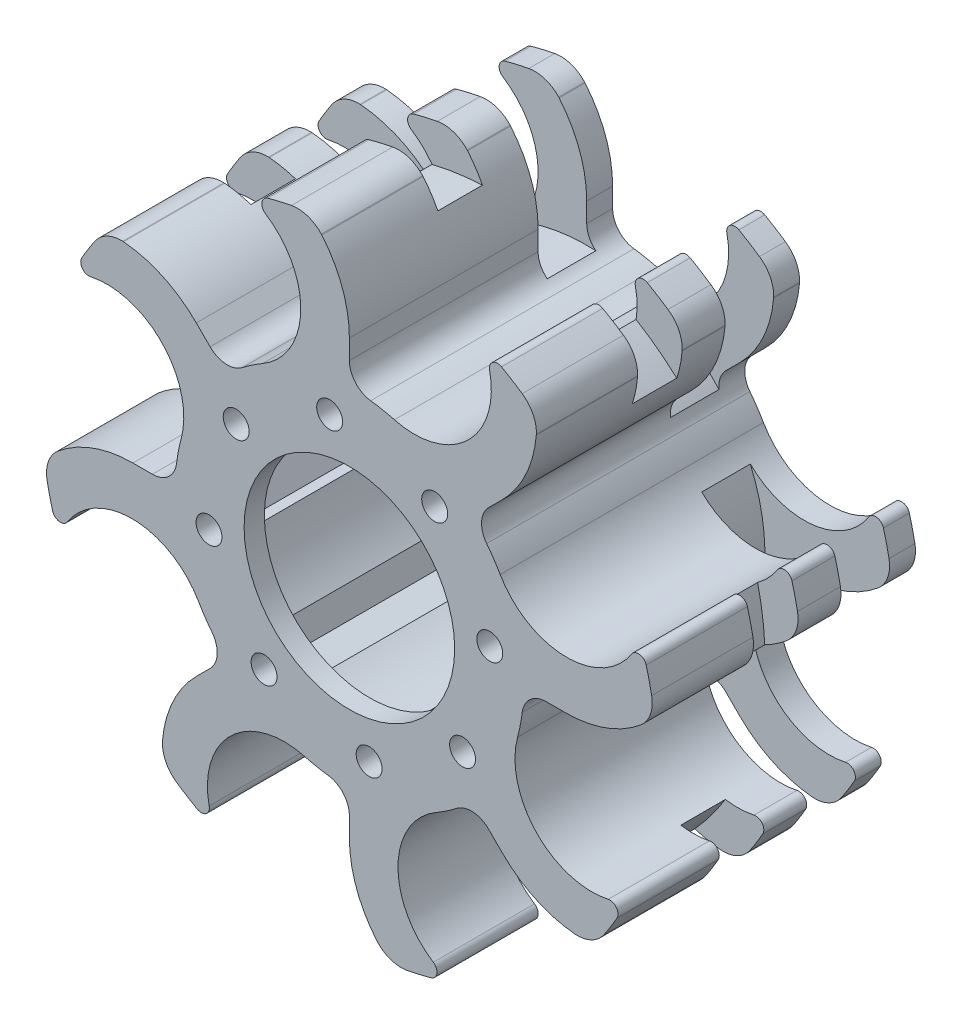
from build123d import *

# Parameters (mm, degrees)
EXTRUDE_1_DEPTH          = 32.5
PATTERN_CIRCULAR_1_COUNT = 8
FILLET_1_R               = 3
SKETCH_3_R               = 18.5
CUT_EXTRUDE_1_DEPTH      = 30
SKETCH_4_R               = 1.6
SKETCH_4_R_2             = 13
CUT_EXTRUDE_2_DEPTH      = 2.5
CUT_EXTRUDE_4_REACH      = 62.798
SKETCH_7_W               = 20
SKETCH_7_H               = 6
SKETCH_7_W_2             = 10
SKETCH_7_H_2             = 5.5


with BuildPart() as part:
    # 草图1 → 凸台-拉伸1 (new body)
    with BuildSketch(Plane.XY):
        with BuildLine():
            ThreePointArc((-10.356244554, 34.83376316), (-6.00280003, 26.616152007), (-10.75, 18.619546181))
            ThreePointArc((-10.75, 18.619546181), (5.56460947, -20.767405265), (0, 21.5))
            Line((0, 21.5), (0, 26.721510215))
            ThreePointArc((0, 26.721510215), (-0.876562566, 31.680090761), (-3.4, 36.037629801))
            ThreePointArc((-3.4, 36.037629801), (-3.429921119, 36.072346995), (-3.460629906, 36.106369449))
            ThreePointArc((-3.460629906, 36.106369449), (-5.148861305, 37.192002716), (-7.15188578, 37.320912767))
            ThreePointArc((-7.15188578, 37.320912767), (-8.622723673, 37.00876432), (-10.080061386, 36.638673044))
            ThreePointArc((-10.080061386, 36.638673044), (-10.803291061, 35.82575459), (-10.356244554, 34.83376316))
        make_face()
    extrude_1 = extrude(amount=EXTRUDE_1_DEPTH)

    # 阵列(圆周)1: 凸台-拉伸1 ×8 about axis
    pattern_circular_1_axis = Axis((0, 0, 0), (0, 0, 1))
    for i in range(1, PATTERN_CIRCULAR_1_COUNT):
        add(extrude_1.rotate(pattern_circular_1_axis, i * 360 / PATTERN_CIRCULAR_1_COUNT))

    # 圆角1
    fillet_1_edges = [part.edges().sort_by_distance(p)[0] for p in [
        (0, 21.5, 16.25),
        (-15.202795796, 15.202795796, 16.25),
        (-15.202795796, -15.202795796, 16.25),
        (15.202795796, -15.202795796, 16.25),
        (15.202795796, 15.202795796, 16.25),
        (21.5, 0, 16.25),
        (0, -21.5, 16.25),
        (-21.5, 0, 16.25),
    ]]
    fillet(fillet_1_edges, radius=FILLET_1_R)

    # 草图3 → 切除-拉伸1 (cut)
    with BuildSketch(Plane(origin=(0, 0, 0), x_dir=(-1, 0, 0), z_dir=(0, 0, -1))):
        Circle(SKETCH_3_R)
    extrude(amount=-CUT_EXTRUDE_1_DEPTH, mode=Mode.SUBTRACT)

    # 草图4 → 切除-拉伸2 (cut)
    with BuildSketch(Plane.XY.offset(32.5)):
        with Locations((-2.435529267, 17.329691203)):
            Circle(SKETCH_4_R)
        Circle(SKETCH_4_R_2)
        with Locations((10.531762905, 13.976121426)):
            Circle(SKETCH_4_R)
        with Locations((17.329691203, 2.435529267)):
            Circle(SKETCH_4_R)
        with Locations((13.976121426, -10.531762905)):
            Circle(SKETCH_4_R)
        with Locations((2.435529267, -17.329691203)):
            Circle(SKETCH_4_R)
        with Locations((-10.531762905, -13.976121426)):
            Circle(SKETCH_4_R)
        with Locations((-17.329691203, -2.435529267)):
            Circle(SKETCH_4_R)
        with Locations((-13.976121426, 10.531762905)):
            Circle(SKETCH_4_R)
    extrude(amount=-CUT_EXTRUDE_2_DEPTH, mode=Mode.SUBTRACT)

    # 草图6 → 切除-拉伸4 (cut, up to next)
    with BuildSketch(Plane(origin=(0, 0, 30), x_dir=(-1, 0, 0), z_dir=(0, 0, -1)), mode=Mode.PRIVATE) as cut_extrude_4_sk1:
        Polygon((2.435529267, 20.629691203), (-0.422354566, 18.979691203), (-0.422354566, 15.679691203), (2.435529267, 14.029691203), (5.293413099, 15.679691203), (5.293413099, 18.979691203), align=None)
    cut_extrude_4_tool1 = extrude(cut_extrude_4_sk1.sketch, amount=CUT_EXTRUDE_4_REACH, mode=Mode.PRIVATE) & part.part
    # 草图6 → 切除-拉伸4 (cut, up to next)
    with BuildSketch(Plane(origin=(0, 0, 30), x_dir=(-1, 0, 0), z_dir=(0, 0, -1)), mode=Mode.PRIVATE) as cut_extrude_4_sk2:
        Polygon((16.309573804, 12.865215283), (13.122018577, 13.719318132), (10.788566199, 11.385865754), (11.642669048, 8.198310527), (14.830224275, 7.344207678), (17.163676653, 9.677660056), align=None)
    cut_extrude_4_tool2 = extrude(cut_extrude_4_sk2.sketch, amount=CUT_EXTRUDE_4_REACH, mode=Mode.PRIVATE) & part.part
    # 草图6 → 切除-拉伸4 (cut, up to next)
    with BuildSketch(Plane(origin=(0, 0, 30), x_dir=(-1, 0, 0), z_dir=(0, 0, -1)), mode=Mode.PRIVATE) as cut_extrude_4_sk3:
        Polygon((20.629691203, -2.435529267), (18.979691203, 0.422354566), (15.679691203, 0.422354566), (14.029691203, -2.435529267), (15.679691203, -5.293413099), (18.979691203, -5.293413099), align=None)
    cut_extrude_4_tool3 = extrude(cut_extrude_4_sk3.sketch, amount=CUT_EXTRUDE_4_REACH, mode=Mode.PRIVATE) & part.part
    # 草图6 → 切除-拉伸4 (cut, up to next)
    with BuildSketch(Plane(origin=(0, 0, 30), x_dir=(-1, 0, 0), z_dir=(0, 0, -1)), mode=Mode.PRIVATE) as cut_extrude_4_sk4:
        Polygon((12.865215283, -16.309573804), (13.719318132, -13.122018577), (11.385865754, -10.788566199), (8.198310527, -11.642669048), (7.344207678, -14.830224275), (9.677660056, -17.163676653), align=None)
    cut_extrude_4_tool4 = extrude(cut_extrude_4_sk4.sketch, amount=CUT_EXTRUDE_4_REACH, mode=Mode.PRIVATE) & part.part
    # 草图6 → 切除-拉伸4 (cut, up to next)
    with BuildSketch(Plane(origin=(0, 0, 30), x_dir=(-1, 0, 0), z_dir=(0, 0, -1)), mode=Mode.PRIVATE) as cut_extrude_4_sk5:
        Polygon((-2.435529267, -20.629691203), (0.422354566, -18.979691203), (0.422354566, -15.679691203), (-2.435529267, -14.029691203), (-5.293413099, -15.679691203), (-5.293413099, -18.979691203), align=None)
    cut_extrude_4_tool5 = extrude(cut_extrude_4_sk5.sketch, amount=CUT_EXTRUDE_4_REACH, mode=Mode.PRIVATE) & part.part
    # 草图6 → 切除-拉伸4 (cut, up to next)
    with BuildSketch(Plane(origin=(0, 0, 30), x_dir=(-1, 0, 0), z_dir=(0, 0, -1)), mode=Mode.PRIVATE) as cut_extrude_4_sk6:
        Polygon((-16.309573804, -12.865215283), (-13.122018577, -13.719318132), (-10.788566199, -11.385865754), (-11.642669048, -8.198310527), (-14.830224275, -7.344207678), (-17.163676653, -9.677660056), align=None)
    cut_extrude_4_tool6 = extrude(cut_extrude_4_sk6.sketch, amount=CUT_EXTRUDE_4_REACH, mode=Mode.PRIVATE) & part.part
    # 草图6 → 切除-拉伸4 (cut, up to next)
    with BuildSketch(Plane(origin=(0, 0, 30), x_dir=(-1, 0, 0), z_dir=(0, 0, -1)), mode=Mode.PRIVATE) as cut_extrude_4_sk7:
        Polygon((-20.629691203, 2.435529267), (-18.979691203, -0.422354566), (-15.679691203, -0.422354566), (-14.029691203, 2.435529267), (-15.679691203, 5.293413099), (-18.979691203, 5.293413099), align=None)
    cut_extrude_4_tool7 = extrude(cut_extrude_4_sk7.sketch, amount=CUT_EXTRUDE_4_REACH, mode=Mode.PRIVATE) & part.part
    # 草图6 → 切除-拉伸4 (cut, up to next)
    with BuildSketch(Plane(origin=(0, 0, 30), x_dir=(-1, 0, 0), z_dir=(0, 0, -1)), mode=Mode.PRIVATE) as cut_extrude_4_sk8:
        Polygon((-12.865215283, 16.309573804), (-13.719318132, 13.122018577), (-11.385865754, 10.788566199), (-8.198310527, 11.642669048), (-7.344207678, 14.830224275), (-9.677660056, 17.163676653), align=None)
    cut_extrude_4_tool8 = extrude(cut_extrude_4_sk8.sketch, amount=CUT_EXTRUDE_4_REACH, mode=Mode.PRIVATE) & part.part
    add(cut_extrude_4_tool1.solids().sort_by_distance((-2.435529, 17.329691, 30))[0], mode=Mode.SUBTRACT)
    add(cut_extrude_4_tool2.solids().sort_by_distance((-13.976121, 10.531763, 30))[0], mode=Mode.SUBTRACT)
    add(cut_extrude_4_tool3.solids().sort_by_distance((-17.329691, -2.435529, 30))[0], mode=Mode.SUBTRACT)
    add(cut_extrude_4_tool4.solids().sort_by_distance((-10.531763, -13.976121, 30))[0], mode=Mode.SUBTRACT)
    add(cut_extrude_4_tool5.solids().sort_by_distance((2.435529, -17.329691, 30))[0], mode=Mode.SUBTRACT)
    add(cut_extrude_4_tool6.solids().sort_by_distance((13.976121, -10.531763, 30))[0], mode=Mode.SUBTRACT)
    add(cut_extrude_4_tool7.solids().sort_by_distance((17.329691, 2.435529, 30))[0], mode=Mode.SUBTRACT)
    add(cut_extrude_4_tool8.solids().sort_by_distance((10.531763, 13.976121, 30))[0], mode=Mode.SUBTRACT)

    # 草图7 → 切除-旋转1 (revolve, cut)
    with BuildSketch(Plane(origin=(0, 0, 0), x_dir=(1, 0, 0), z_dir=(0, 1, 0))):
        with Locations((32, -6.2)):
            Rectangle(SKETCH_7_W, SKETCH_7_H)
        with Locations((38.320912767, -17.25)):
            Rectangle(SKETCH_7_W_2, SKETCH_7_H_2)
    revolve(axis=Axis((0, 0, 0), (0, 0, -1)), mode=Mode.SUBTRACT)


solid = part.part
